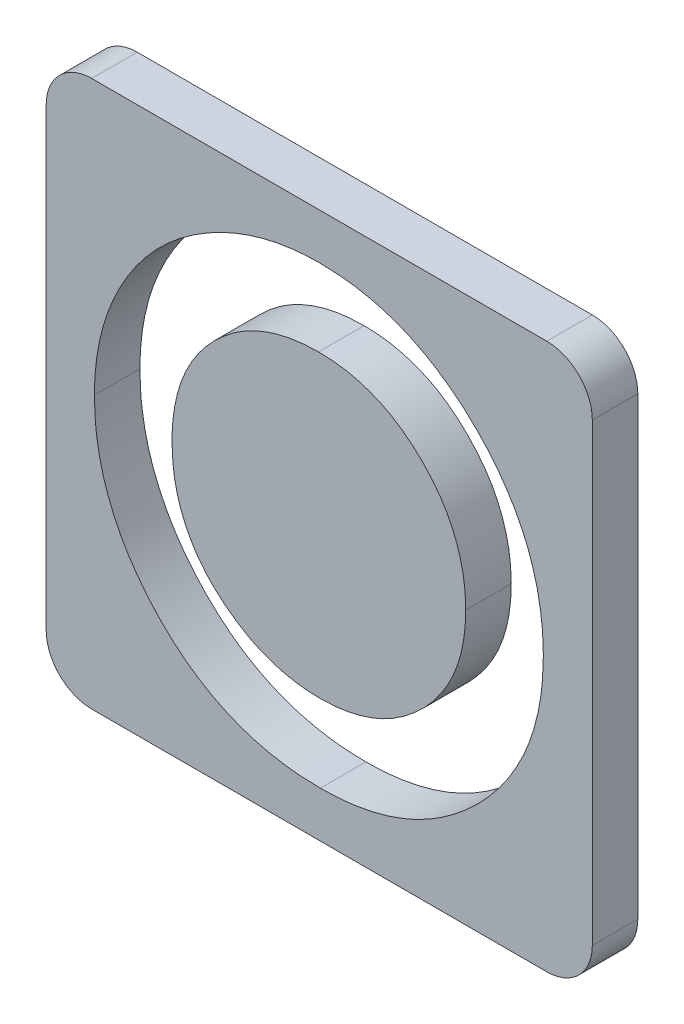
from build123d import *

# Parameters (mm, degrees)
BOSS_EXTRUDE1_DEPTH = 10
CUT_EXTRUDE28_DEPTH = 10


with BuildPart() as part:
    # Sketch1 → Boss-Extrude1 (new body)
    with BuildSketch(Plane.XY):
        with BuildLine():
            Line((-50, 60), (50, 60))
            ThreePointArc((50, 60), (57.071067812, 57.071067812), (60, 50))
            Line((60, 50), (60, -50))
            ThreePointArc((60, -50), (57.071067812, -57.071067812), (50, -60))
            Line((50, -60), (-50, -60))
            ThreePointArc((-50, -60), (-57.071067812, -57.071067812), (-60, -50))
            Line((-60, -50), (-60, 50))
            ThreePointArc((-60, 50), (-57.071067812, 57.071067812), (-50, 60))
        make_face()
    extrude(amount=BOSS_EXTRUDE1_DEPTH)

    # Sketch2 → Cut-Extrude28 (cut)
    with BuildSketch(Plane.XY.offset(10)):
        with BuildLine():
            add(Edge.make_bspline(
                [(0.106971154, 49.935897436), (1.758662582, 49.893132187), (5.019475563, 49.808703899), (9.814954752, 49.10492823), (14.436285632, 47.958226673), (18.881378449, 46.364228567), (23.139103204, 44.279760346), (27.224478315, 41.763918049), (31.122870164, 38.769216661), (34.794331157, 35.365517625), (38.187423276, 31.664143545), (41.127539579, 27.678956295), (43.6347629, 23.513216081), (45.712756297, 19.155760679), (47.295535048, 14.576412634), (48.406236364, 9.798520568), (49.119806932, 4.823443746), (49.201878527, 1.436094542), (49.243589744, -0.285456731)],
                knots=[0, 0, 0, 0, 1.014329547, 2.002516266, 2.970391464, 3.935626869, 4.897733899, 5.877609409, 6.878433252, 7.912639331, 8.949961323, 9.958554974, 10.949718813, 11.932905612, 12.9188844, 13.919928257, 14.942845884, 16, 16, 16, 16], degree=3))
            add(Edge.make_bspline(
                [(49.243589744, -0.285456731), (49.199169102, -1.987610097), (49.111636803, -5.341757915), (48.435367439, -10.270987444), (47.305961773, -14.997698332), (45.750028191, -19.532589595), (43.709721738, -23.853695777), (41.251392002, -27.988606538), (38.310168333, -31.898948917), (34.99332871, -35.582624476), (31.341776131, -38.926350477), (27.474202274, -41.87300324), (23.408465206, -44.369885593), (19.150515867, -46.415853842), (14.691223289, -48.003654451), (10.041602472, -49.123963157), (5.20194113, -49.804797378), (1.91073672, -49.891757925), (0.240184295, -49.935897436)],
                knots=[0, 0, 0, 0, 1.051557043, 2.072126891, 3.067553643, 4.050577992, 5.02905126, 6.015227836, 7.017913613, 8.04756643, 9.074058332, 10.072836633, 11.047628519, 12.017157415, 12.98668631, 13.966869689, 14.968021931, 16, 16, 16, 16], degree=3))
            add(Edge.make_bspline(
                [(0.240184295, -49.935897436), (-1.507013234, -49.896302119), (-4.940017558, -49.818502734), (-9.964234753, -49.078666096), (-14.777868956, -47.964213673), (-19.340482865, -46.300953219), (-23.698542806, -44.221737793), (-27.82002883, -41.661059338), (-31.703555849, -38.623149574), (-35.326847315, -35.185810498), (-38.609558159, -31.424607627), (-41.507194384, -27.451230333), (-43.951414819, -23.296031725), (-45.942308892, -18.957067081), (-47.511849804, -14.461302012), (-48.618982586, -9.78135601), (-49.27299234, -4.928453285), (-49.364092101, -1.632264744), (-49.41025641, 0.038060897)],
                knots=[0, 0, 0, 0, 1.067978421, 2.098431617, 3.099715153, 4.085208694, 5.062210972, 6.048429807, 7.046490867, 8.072918869, 9.098532598, 10.095778865, 11.076610158, 12.041847152, 13.011192615, 13.984257998, 14.978533688, 16, 16, 16, 16], degree=3))
            add(Edge.make_bspline(
                [(-49.41025641, 0.038060897), (-49.395767391, 1.161768547), (-49.366972815, 3.39495513), (-49.020111826, 6.704423652), (-48.520731728, 9.949295792), (-47.782172257, 13.116634197), (-46.885011267, 16.228782967), (-45.722612472, 19.256773451), (-44.399488071, 22.232952914), (-42.853541785, 25.122168949), (-41.134598995, 27.897838356), (-39.25907937, 30.546867816), (-37.222266939, 33.037226692), (-35.030722951, 35.385280596), (-32.676895049, 37.575595599), (-30.191745408, 39.639178659), (-27.527076593, 41.521213673), (-24.741209846, 43.26766369), (-21.849851243, 44.846948152), (-18.864771235, 46.191187855), (-15.847468368, 47.365089491), (-12.757635544, 48.291584568), (-9.628385819, 49.046205114), (-6.426289498, 49.545248631), (-3.180275702, 49.892100015), (-0.991378229, 49.921263649), (0.106971154, 49.935897436)],
                knots=[0, 0, 0, 0, 1.034744296, 2.056386356, 3.06226378, 4.057406941, 5.050368692, 6.043467995, 7.042652155, 8.049140477, 9.059438543, 10.048523776, 11.036952808, 12.020949711, 13.004946614, 13.997082645, 14.994316842, 16.007702937, 17.024872941, 18.026463647, 19.021641123, 20.005082605, 20.995858141, 21.984425357, 22.988620895, 24, 24, 24, 24], degree=3))
        make_face()
        with BuildLine():
            add(Edge.make_bspline(
                [(-0.159455128, 32.884615385), (-1.271043241, 32.85478898), (-3.464873358, 32.795923592), (-6.682822609, 32.347448955), (-9.772167532, 31.631183982), (-12.715782666, 30.593682922), (-15.526425897, 29.273207392), (-18.209079622, 27.674371293), (-20.726594635, 25.742216423), (-23.112539564, 23.580471561), (-25.267848195, 21.171790985), (-27.172131364, 18.590480109), (-28.765709657, 15.84084968), (-30.100341461, 12.948443113), (-31.105023413, 9.880736062), (-31.820628245, 6.661758209), (-32.272863787, 3.285963096), (-32.329868639, 0.984687962), (-32.358974359, -0.190304487)],
                knots=[0, 0, 0, 0, 1.033739768, 2.040188636, 3.016340934, 3.979330865, 4.937572243, 5.900995986, 6.878200029, 7.884839167, 8.891893314, 9.879764717, 10.863503415, 11.843163062, 12.837761627, 13.859916423, 14.907309254, 16, 16, 16, 16], degree=3))
            add(Edge.make_bspline(
                [(-32.358974359, -0.190304487), (-32.320384617, -1.492460432), (-32.244755118, -4.044470326), (-31.712616761, -7.767273602), (-30.802181003, -11.283091808), (-29.48752947, -14.574729602), (-27.857016666, -17.678738159), (-25.832178542, -20.55707344), (-23.44580789, -23.226969572), (-21.607367274, -24.785766143), (-20.674278846, -25.576923077)],
                knots=[0, 0, 0, 0, 1.078454662, 2.113592447, 3.107694534, 4.079536787, 5.043276885, 6.005368276, 6.987637804, 8, 8, 8, 8], degree=3))
            add(Edge.make_bspline(
                [(-20.674278846, -25.576923077), (-19.909901286, -26.161399433), (-18.398367723, -27.317183795), (-15.985631068, -28.798558557), (-13.500987404, -30.068244504), (-10.925686979, -31.09413573), (-8.265168694, -31.901084523), (-5.519797389, -32.466177495), (-2.693463022, -32.820822204), (-0.782163267, -32.863208965), (0.183092949, -32.884615385)],
                knots=[0, 0, 0, 0, 1.023928204, 2.024787132, 3.009472467, 3.9914905, 4.972207045, 5.96565515, 6.972602802, 8, 8, 8, 8], degree=3))
            add(Edge.make_bspline(
                [(0.183092949, -32.884615385), (1.275567277, -32.854536085), (3.425044876, -32.795354117), (6.583090263, -32.352400448), (9.608593662, -31.602762911), (12.520337653, -30.574363178), (15.309926069, -29.237307936), (17.963725429, -27.588880956), (20.486388567, -25.649322801), (22.869293834, -23.459189495), (25.04738189, -21.041020383), (26.947691214, -18.445941061), (28.591937334, -15.731128895), (29.898815449, -12.858159834), (30.943190115, -9.854153361), (31.65018227, -6.70580538), (32.106238176, -3.426094574), (32.163259089, -1.19413547), (32.192307692, -0.057091346)],
                knots=[0, 0, 0, 0, 1.026359118, 2.019393844, 2.989460624, 3.950973911, 4.916101784, 5.890408035, 6.881132271, 7.902007068, 8.92769091, 9.933912415, 10.920395702, 11.90457117, 12.894218921, 13.903490204, 14.931958862, 16, 16, 16, 16], degree=3))
            add(Edge.make_bspline(
                [(32.192307692, -0.057091346), (32.162254004, 1.07341446), (32.103097901, 3.298642726), (31.659364607, 6.569921417), (30.914481078, 9.704370365), (29.882993168, 12.707108457), (28.565837729, 15.58107949), (26.937041406, 18.316176884), (25.002319445, 20.909756467), (22.806199351, 23.344143987), (20.415857605, 25.581190182), (17.8495869, 27.522539625), (15.179194371, 29.209510567), (12.343408185, 30.531015484), (9.400246153, 31.583855648), (6.331748943, 32.359182252), (3.126294435, 32.792773036), (0.945557456, 32.853728383), (-0.159455128, 32.884615385)],
                knots=[0, 0, 0, 0, 1.055025985, 2.07665775, 3.074803781, 4.057872707, 5.035505728, 6.020516407, 7.023567878, 8.050795229, 9.077271434, 10.074415901, 11.050397877, 12.019801805, 12.988065821, 13.964604439, 14.968634123, 16, 16, 16, 16], degree=3))
        make_face(mode=Mode.SUBTRACT)
    extrude(amount=-CUT_EXTRUDE28_DEPTH, mode=Mode.SUBTRACT)


with BuildPart() as cut_extrude28_piece_1:
    # of the separate pieces the step leaves, piece 1, a body of its own (cut_extrude28_pieces)
    add(part.part.solids().sort_by_distance((-50, 60, 0))[0])


with BuildPart() as cut_extrude28_piece_2:
    # of the separate pieces the step leaves, piece 2, a body of its own (cut_extrude28_pieces)
    add(part.part.solids().sort_by_distance((-0.159455128, 32.884615385, 0))[0])


solid = Compound([cut_extrude28_piece_1.part, cut_extrude28_piece_2.part])
